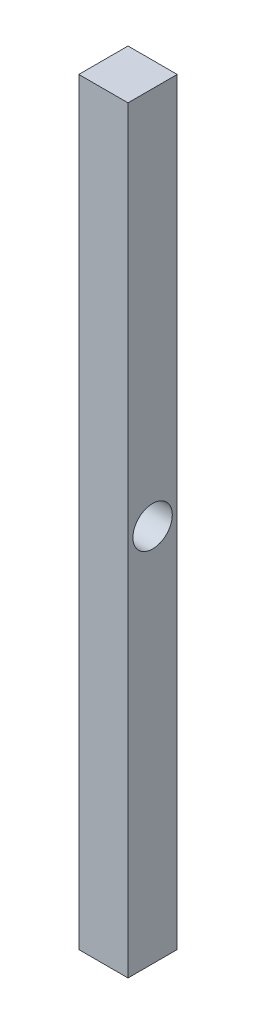
from build123d import *

# Parameters (mm, degrees)
SKETCH1_W               = 10
SKETCH1_H               = 10
BOSS_EXTRUDE1_DEPTH     = 154
CUT_EXTRUDE1_DEPTH      = 155.405310789
CUT_EXTRUDE1_DEPTH_BACK = 155.405310789
SKETCH2_R               = 4


with BuildPart() as part:
    # Sketch1 → Boss-Extrude1 (new body)
    with BuildSketch(Plane(origin=(0, 0, 0), x_dir=(1, 0, 0), z_dir=(0, 1, 0))):
        Rectangle(SKETCH1_W, SKETCH1_H)
    extrude(amount=BOSS_EXTRUDE1_DEPTH)

    # Sketch2 → Cut-Extrude1 (cut, two sides: drawn at the far end of the back side and taken through both)
    with BuildSketch(Plane(origin=(5, 0, 0), x_dir=(0, 0, -1), z_dir=(1, 0, 0)).offset(-CUT_EXTRUDE1_DEPTH_BACK)):
        with Locations((0, 77)):
            Circle(SKETCH2_R)
    extrude(amount=CUT_EXTRUDE1_DEPTH + CUT_EXTRUDE1_DEPTH_BACK, mode=Mode.SUBTRACT)


solid = part.part
